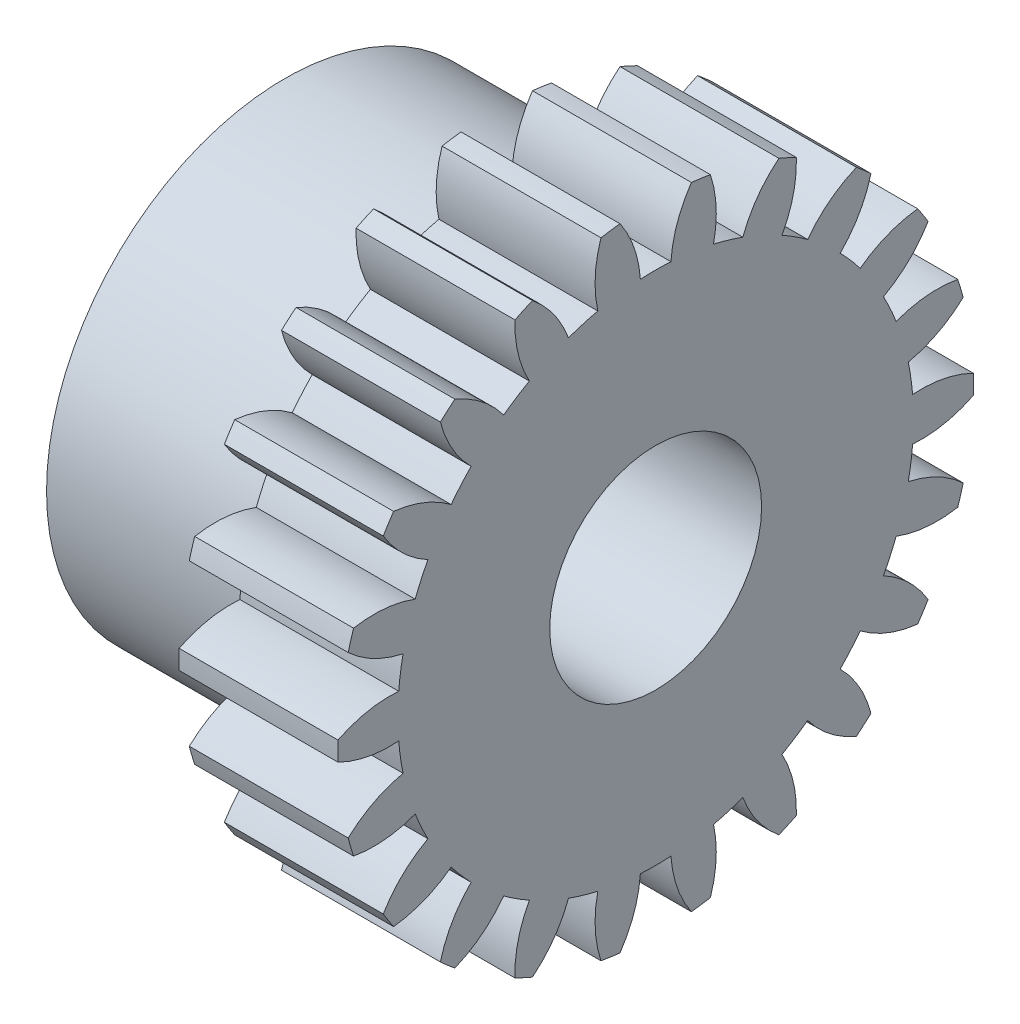
from build123d import *

# Parameters (mm, degrees)
BASPROSKE_W      = 4.7625
BASPROSKE_H      = 9.525
TOOTHCUT_DEPTH   = 15.2875
TEETHCUTS_COUNT  = 22
TEETHCUTS_ANGLE  = 343.636363636
HUBNEAONESKE_R   = 7.14375
HUBNEARONE_DEPTH = 6.3500508
BORSKE_R         = 3.175
BORE_DEPTH       = 11.1125508


with BuildPart() as part:
    # BasProSke → Base-Revolve (revolve)
    with BuildSketch(Plane(origin=(0, 0, 0), x_dir=(1, 0, 0), z_dir=(0, 1, 0)), mode=Mode.PRIVATE) as base_revolve_sk:
        with Locations((2.38125, 4.7625)):
            Rectangle(BASPROSKE_W, BASPROSKE_H)
    revolve(base_revolve_sk.sketch.rotate(Axis((-10, 0, 0), (1, 0, 0)), 180), axis=Axis((-10, 0, 0), (1, 0, 0)))

    # TooCutSke → ToothCut (cut, through all)
    with BuildSketch(Plane(origin=(0, 0, 0), x_dir=(0, 0, -1), z_dir=(1, 0, 0))):
        with BuildLine():
            ThreePointArc((0.457778383, 7.714379441), (0, 7.72795), (-0.457778383, 7.714379441))
            ThreePointArc((-0.457778383, 7.714379441), (-0.650468533, 8.644541408), (-1.086672077, 9.488376255))
            ThreePointArc((-1.086672077, 9.488376255), (0, 9.5504), (1.086672077, 9.488376255))
            ThreePointArc((1.086672077, 9.488376255), (0.650468533, 8.644541408), (0.457778383, 7.714379441))
        make_face()
    toothcut = extrude(amount=TOOTHCUT_DEPTH, mode=Mode.SUBTRACT)

    # TeethCuts: ToothCut ×22 about axis
    teethcuts_axis = Axis((-10, 0, 0), (1, 0, 0))
    for i in range(1, TEETHCUTS_COUNT):
        add(toothcut.rotate(teethcuts_axis, i * TEETHCUTS_ANGLE / (TEETHCUTS_COUNT - 1)), mode=Mode.SUBTRACT)

    # HubNeaOneSke → HubNearOne (add)
    with BuildSketch(Plane.ZY):
        with Locations(Location((0, 0, 0), (0, 0, 180))):
            Circle(HUBNEAONESKE_R)
    extrude(amount=HUBNEARONE_DEPTH)

    # BorSke → Bore (cut, symmetric)
    with BuildSketch(Plane(origin=(0, 0, 0), x_dir=(0, 0, -1), z_dir=(1, 0, 0))):
        with Locations(Location((0, 0, 0), (0, 0, 180))):
            Circle(BORSKE_R)
    extrude(amount=BORE_DEPTH, both=True, mode=Mode.SUBTRACT)


solid = part.part
